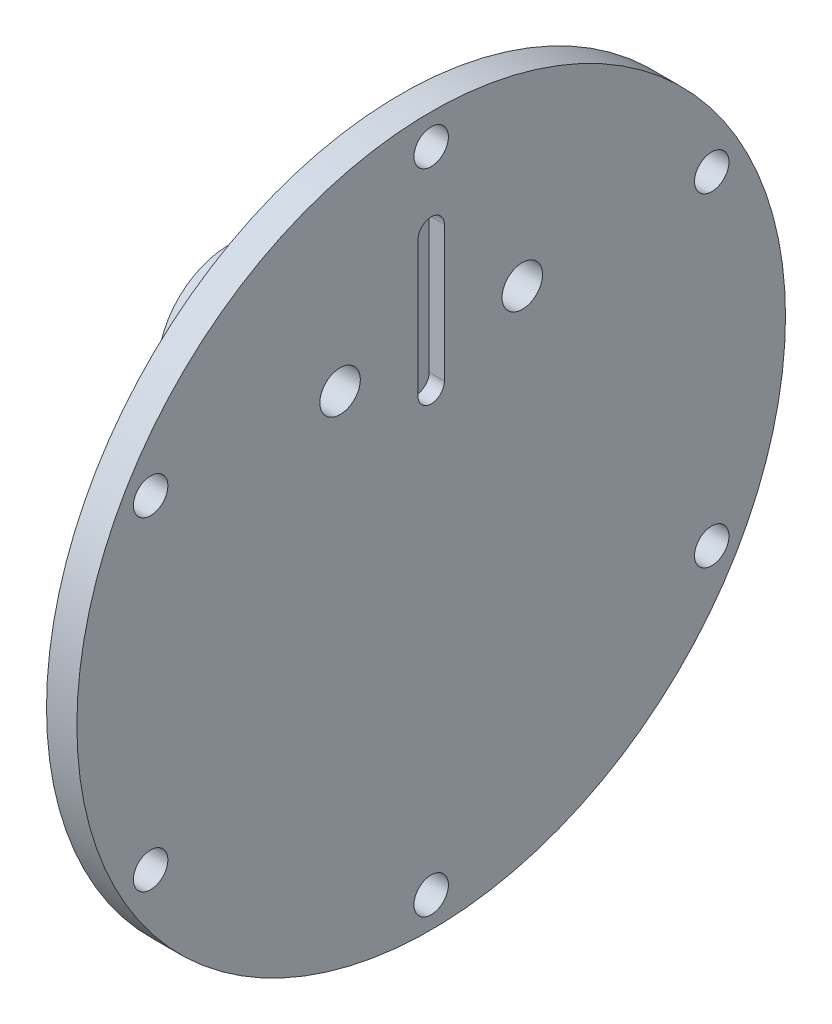
from build123d import *

# Parameters (mm, degrees)
COVER_DISK_OD70_THICKNESS3_W                   = 3
COVER_DISK_OD70_THICKNESS3_H                   = 35
INTEGRAL_START                                 = -11
TWO_INTEGRAL_OD14_PORT_BOSSES_SKETCH_R         = 7
INTEGRAL_PORT_BOSSES_REAR8MM_DEPTH             = 8
SIX_START                                      = -3
SIX_M3_CLEARANCE_HOLES_DIAMETER3P4_P_2_R       = 1.7
SIX_M3_CLEARANCE_HOLES_DIAMETER3P4_PCD64_DEPTH = 3
TWO_START                                      = -11
TWO_G1_8_TAPPING_PILOT_ENVELOPES_DIA_2_R       = 4.4
TWO_G1_8_TAPPING_PILOT_ENVELOPES_DIAMETE_DEPTH = 7
TWO_WATER_PASSAGES_DIAMETER4_SKETCH_R          = 2
TWO_WATER_PASSAGES_DIAMETER4_DEPTH             = 11
INTERNAL_START                                 = -1.5
INTERNAL_BYPASS_STRIP_GROOVE_LENGTH16_WI_DEPTH = 1.5


with BuildPart() as part:
    # Cover disk OD70 thickness3 → One-piece copper cover blank (revolve)
    with BuildSketch(Plane.XY, mode=Mode.PRIVATE) as one_piece_copper_cover_blank_sk:
        with Locations((-1.5, 17.5)):
            Rectangle(COVER_DISK_OD70_THICKNESS3_W, COVER_DISK_OD70_THICKNESS3_H)
    revolve(one_piece_copper_cover_blank_sk.sketch.rotate(Axis((-30, 0, 0), (1, 0, 0)), 90), axis=Axis((-30, 0, 0), (1, 0, 0)))

    # Two integral OD14 port bosses sketch → Integral port bosses rear8mm (add)
    with BuildSketch(Plane(origin=(0, 0, 0), x_dir=(0, 0, -1), z_dir=(1, 0, 0)).offset(INTEGRAL_START)):
        with Locations((-9, 15.588457268)):
            Circle(TWO_INTEGRAL_OD14_PORT_BOSSES_SKETCH_R)
        with Locations((9, 15.588457268)):
            Circle(TWO_INTEGRAL_OD14_PORT_BOSSES_SKETCH_R)
    extrude(amount=INTEGRAL_PORT_BOSSES_REAR8MM_DEPTH)

    # Six M3 clearance holes diameter3p4 P 2 → Six M3 clearance holes diameter3p4 PCD64 (cut)
    with BuildSketch(Plane(origin=(0, 0, 0), x_dir=(0, 0, -1), z_dir=(1, 0, 0)).offset(SIX_START)):
        with Locations((0, 32)):
            Circle(SIX_M3_CLEARANCE_HOLES_DIAMETER3P4_P_2_R)
        with Locations((-27.712812921, 16)):
            Circle(SIX_M3_CLEARANCE_HOLES_DIAMETER3P4_P_2_R)
        with Locations((-27.712812921, -16)):
            Circle(SIX_M3_CLEARANCE_HOLES_DIAMETER3P4_P_2_R)
        with Locations((0, -32)):
            Circle(SIX_M3_CLEARANCE_HOLES_DIAMETER3P4_P_2_R)
        with Locations((27.712812921, -16)):
            Circle(SIX_M3_CLEARANCE_HOLES_DIAMETER3P4_P_2_R)
        with Locations((27.712812921, 16)):
            Circle(SIX_M3_CLEARANCE_HOLES_DIAMETER3P4_P_2_R)
    extrude(amount=SIX_M3_CLEARANCE_HOLES_DIAMETER3P4_PCD64_DEPTH, mode=Mode.SUBTRACT)

    # Two G1-8 tapping pilot envelopes dia 2 → Two G1-8 tapping pilot envelopes diamete (cut)
    with BuildSketch(Plane(origin=(0, 0, 0), x_dir=(0, 0, -1), z_dir=(1, 0, 0)).offset(TWO_START)):
        with Locations((-9, 15.588457268)):
            Circle(TWO_G1_8_TAPPING_PILOT_ENVELOPES_DIA_2_R)
        with Locations((9, 15.588457268)):
            Circle(TWO_G1_8_TAPPING_PILOT_ENVELOPES_DIA_2_R)
    extrude(amount=TWO_G1_8_TAPPING_PILOT_ENVELOPES_DIAMETE_DEPTH, mode=Mode.SUBTRACT)

    # Two water passages diameter4 sketch → Two water passages diameter4 (cut)
    with BuildSketch(Plane(origin=(0, 0, 0), x_dir=(0, 0, -1), z_dir=(1, 0, 0)).offset(TWO_START)):
        with Locations((-9, 15.588457268)):
            Circle(TWO_WATER_PASSAGES_DIAMETER4_SKETCH_R)
        with Locations((9, 15.588457268)):
            Circle(TWO_WATER_PASSAGES_DIAMETER4_SKETCH_R)
    extrude(amount=TWO_WATER_PASSAGES_DIAMETER4_DEPTH, mode=Mode.SUBTRACT)

    # Internal bypass-strip groove length1 2 → Internal bypass-strip groove length16 wi (cut)
    with BuildSketch(Plane(origin=(0, 0, 0), x_dir=(0, 0, -1), z_dir=(1, 0, 0)).offset(INTERNAL_START)):
        with BuildLine():
            Line((1.3, 11.3), (1.3, 24.7))
            ThreePointArc((1.3, 24.7), (0, 26), (-1.3, 24.7))
            Line((-1.3, 24.7), (-1.3, 11.3))
            ThreePointArc((-1.3, 11.3), (0, 10), (1.3, 11.3))
        make_face()
    extrude(amount=INTERNAL_BYPASS_STRIP_GROOVE_LENGTH16_WI_DEPTH, mode=Mode.SUBTRACT)


solid = part.part
